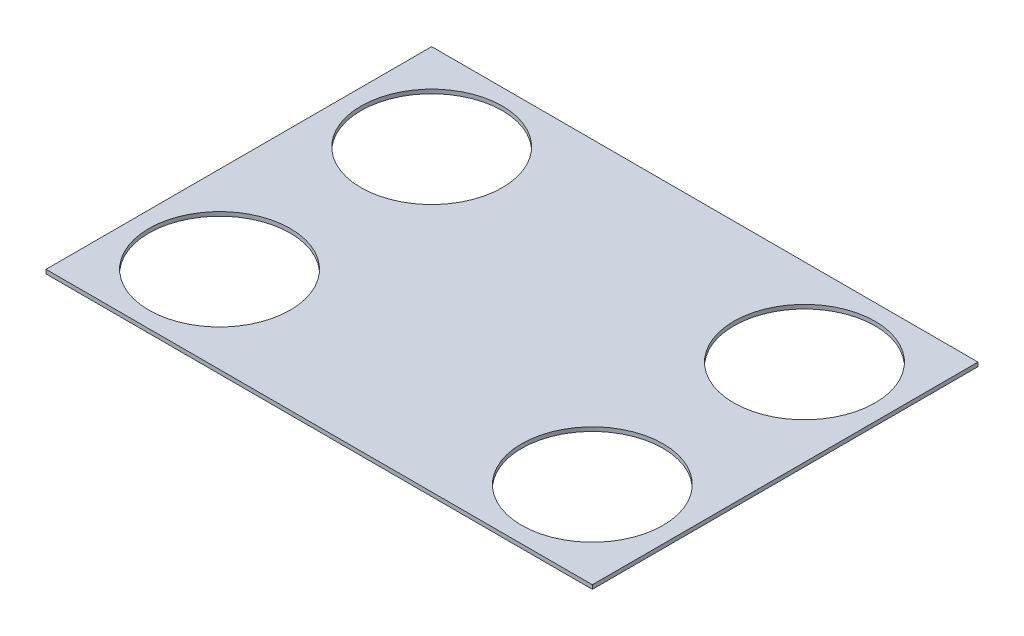
from build123d import *

# Parameters (mm, degrees)
SKETCH1_W           = 431.8
SKETCH1_H           = 304.8
SKETCH1_R           = 55.88
BOSS_EXTRUDE1_DEPTH = 3.175


with BuildPart() as part:
    # Sketch1 → Boss-Extrude1 (new body)
    with BuildSketch(Plane(origin=(0, 0, 0), x_dir=(1, 0, 0), z_dir=(0, 1, 0))):
        with Locations((215.9, 152.4)):
            Rectangle(SKETCH1_W, SKETCH1_H)
        with Locations(Location((68.58, 68.58, 0), (0, 0, 270))):
            Circle(SKETCH1_R, mode=Mode.SUBTRACT)
        with Locations(Location((363.22, 68.58, 0), (0, 0, 270))):
            Circle(SKETCH1_R, mode=Mode.SUBTRACT)
        with Locations(Location((363.22, 236.22, 0), (0, 0, 270))):
            Circle(SKETCH1_R, mode=Mode.SUBTRACT)
        with Locations(Location((68.58, 236.22, 0), (0, 0, 270))):
            Circle(SKETCH1_R, mode=Mode.SUBTRACT)
    extrude(amount=BOSS_EXTRUDE1_DEPTH)


solid = part.part
